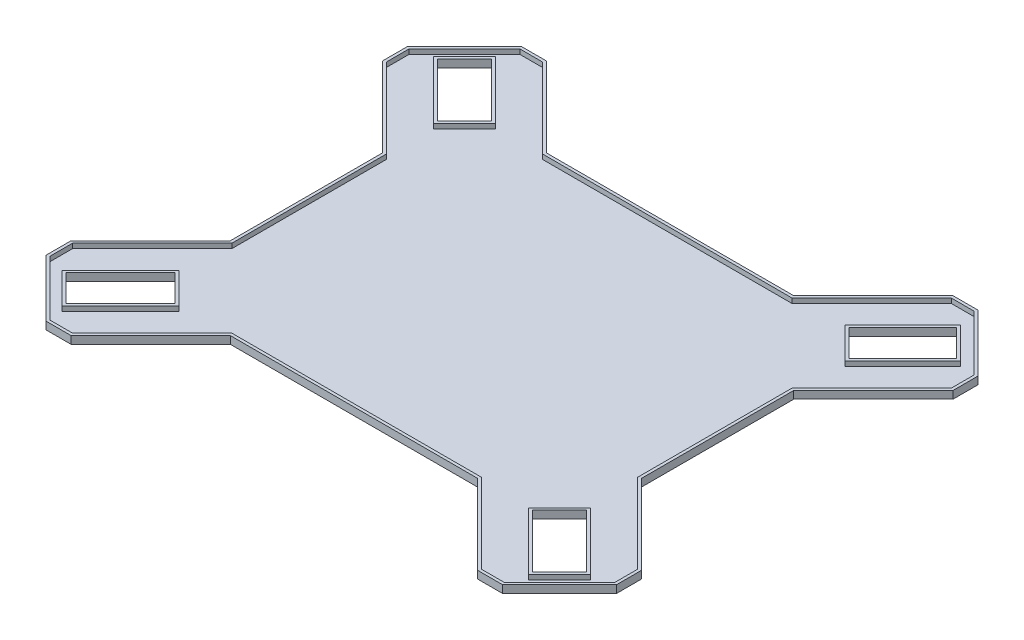
from build123d import *

# Parameters (mm, degrees)
BOSS_EXTRUDE1_DEPTH = 4
CUT_EXTRUDE1_DEPTH  = 5
CUT_EXTRUDE3_DEPTH  = 5
CUT_EXTRUDE4_DEPTH  = 5
CUT_EXTRUDE5_DEPTH  = 5
SHELL1_T            = -1.5


with BuildPart() as part:
    # Sketch1 → Boss-Extrude1 (new body)
    with BuildSketch(Plane(origin=(0, 0, 0), x_dir=(1, 0, 0), z_dir=(0, 1, 0))):
        Polygon((-87.851196474, 52.910261526), (152.148803526, 52.910261526), (182.148803526, 22.910261526), (182.148803526, -167.089738474), (152.148803526, -197.089738474), (-87.851196474, -197.089738474), (-117.851196474, -167.089738474), (-117.851196474, 22.910261526), align=None)
    extrude(amount=BOSS_EXTRUDE1_DEPTH)

    # Sketch2 → Cut-Extrude1 (cut)
    with BuildSketch(Plane(origin=(0, 4, 0), x_dir=(1, 0, 0), z_dir=(0, 1, 0))):
        Polygon((-75.981138789, -72.089738474), (-75.981138789, -32.089738474), (-117.851196474, 9.780319211), (-117.851196474, -153.959796159), (-75.981138789, -112.089738474), align=None)
    extrude(amount=-CUT_EXTRUDE1_DEPTH, mode=Mode.SUBTRACT)

    # Sketch2<5> → Cut-Extrude3 (cut)
    with BuildSketch(Plane(origin=(0, 4, 0), x_dir=(1, 0, 0), z_dir=(0, 1, 0))):
        Polygon((140.278745841, -72.089738474), (140.278745841, -112.089738474), (182.148803526, -153.959796159), (182.148803526, 9.780319211), (140.278745841, -32.089738474), align=None)
    extrude(amount=-CUT_EXTRUDE3_DEPTH, mode=Mode.SUBTRACT)

    # Sketch2<6> → Cut-Extrude4 (cut)
    with BuildSketch(Plane(origin=(0, 4, 0), x_dir=(1, 0, 0), z_dir=(0, 1, 0))):
        Polygon((-61.839003165, -155.219680789), (-75.981138789, -141.077545165), (-104.702510795, -169.798917171), (-90.550656516, -183.95077145), align=None)
        Polygon((-75.981138789, -3.101931783), (-61.839003165, 11.040203841), (-90.123274413, 39.324475088), (-104.265410036, 25.182339465), align=None)
        Polygon((168.563017088, 25.182339465), (154.420881465, 39.324475088), (126.136610217, 11.040203841), (140.278745841, -3.101931783), align=None)
        Polygon((140.278745841, -141.077545165), (126.136610217, -155.219680789), (154.420881465, -183.503952036), (168.563017088, -169.361816413), align=None)
    extrude(amount=-CUT_EXTRUDE4_DEPTH, mode=Mode.SUBTRACT)

    # Sketch2<7> → Cut-Extrude5 (cut)
    with BuildSketch(Plane(origin=(0, 4, 0), x_dir=(1, 0, 0), z_dir=(0, 1, 0))):
        Polygon((139.018803526, 52.910261526), (-74.721196474, 52.910261526), (-32.851138789, 11.040203841), (97.148861211, 11.040203841), align=None)
        Polygon((-74.721196474, -197.089738474), (139.018803526, -197.089738474), (97.148861211, -155.219680789), (-32.851138789, -155.219680789), align=None)
    extrude(amount=-CUT_EXTRUDE5_DEPTH, mode=Mode.SUBTRACT)

    # Shell1
    shell1_openings = [part.faces().sort_by_distance(p)[0] for p in [
        (147.349813653, 4, 162.290748601),
    ]]
    offset(amount=SHELL1_T, openings=shell1_openings, kind=Kind.INTERSECTION)


solid = part.part
